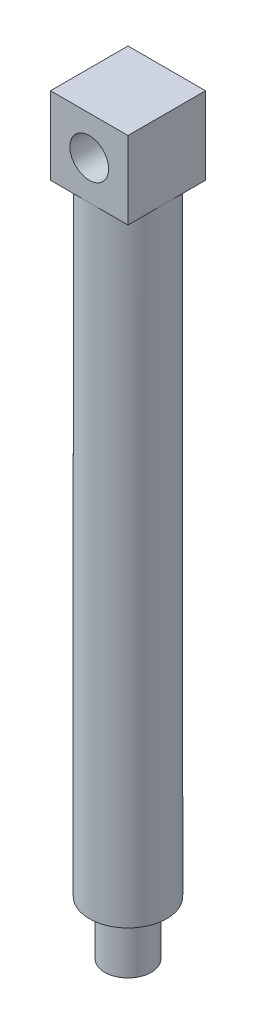
from build123d import *

# Parameters (mm, degrees)
SKETCH2_W           = 10
SKETCH2_H           = 10
BOSS_EXTRUDE2_DEPTH = 10
SKETCH5_R           = 2.5
CUT_EXTRUDE1_DEPTH  = 10
SKETCH6_R           = 5
BOSS_EXTRUDE4_DEPTH = 80
SKETCH7_R           = 3
BOSS_EXTRUDE5_DEPTH = 7


with BuildPart() as part:
    # Sketch2 → Boss-Extrude2 (new body)
    with BuildSketch(Plane.XY):
        with Locations((5, 5)):
            Rectangle(SKETCH2_W, SKETCH2_H)
    extrude(amount=BOSS_EXTRUDE2_DEPTH)

    # Sketch5 → Cut-Extrude1 (cut)
    with BuildSketch(Plane.XY.offset(10)):
        with Locations((5, 5)):
            Circle(SKETCH5_R)
    extrude(amount=-CUT_EXTRUDE1_DEPTH, mode=Mode.SUBTRACT)

    # Sketch6 → Boss-Extrude4 (add)
    with BuildSketch(Plane.XZ):
        with Locations(Location((5, 5, 0), (0, 0, 270))):
            Circle(SKETCH6_R)
    extrude(amount=BOSS_EXTRUDE4_DEPTH)

    # Sketch7 → Boss-Extrude5 (add)
    with BuildSketch(Plane.XZ.offset(80)):
        with Locations(Location((5, 5, 0), (0, 0, 270))):
            Circle(SKETCH7_R)
    extrude(amount=BOSS_EXTRUDE5_DEPTH)


solid = part.part
